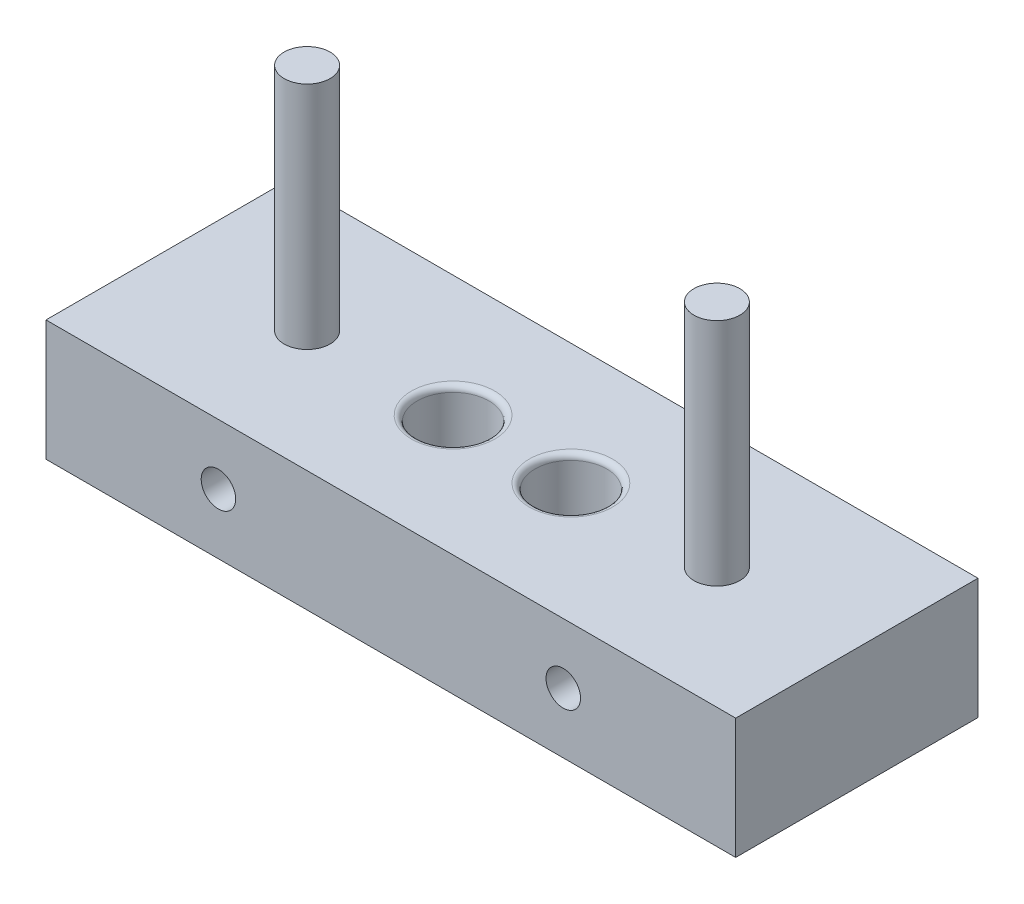
from build123d import *

# Parameters (mm, degrees)
SKETCH1_W           = 120
SKETCH1_H           = 42.16
BOSS_EXTRUDE1_DEPTH = 21
SKETCH2_R           = 6.25
CUT_EXTRUDE1_DEPTH  = 14
SKETCH3_R           = 3.25
CUT_EXTRUDE2_DEPTH  = 82.007752785
FILLET1_R           = 1
FILLET2_R           = 0.5
SKETCH4_R           = 4
BOSS_EXTRUDE2_DEPTH = 40
SKETCH19_R          = 3
CUT_EXTRUDE3_DEPTH  = 107.763288693


with BuildPart() as part:
    # Sketch1 → Boss-Extrude1 (new body)
    with BuildSketch(Plane(origin=(0, 0, 0), x_dir=(1, 0, 0), z_dir=(0, 1, 0))):
        with Locations((16.811029237, -0.514485382)):
            Rectangle(SKETCH1_W, SKETCH1_H)
    extrude(amount=BOSS_EXTRUDE1_DEPTH)

    # Sketch2 → Cut-Extrude1 (cut)
    with BuildSketch(Plane(origin=(0, 21, 0), x_dir=(1, 0, 0), z_dir=(0, 1, 0))):
        with Locations((27.061029237, -0.514485382)):
            Circle(SKETCH2_R)
        with Locations((6.561029237, -0.514485382)):
            Circle(SKETCH2_R)
    extrude(amount=-CUT_EXTRUDE1_DEPTH, mode=Mode.SUBTRACT)

    # Sketch3 → Cut-Extrude2 (cut, through all)
    with BuildSketch(Plane(origin=(0, 7, 0), x_dir=(1, 0, 0), z_dir=(0, 1, 0))):
        with Locations((27.061029237, -0.514485382)):
            Circle(SKETCH3_R)
        with Locations((6.561029237, -0.514485382)):
            Circle(SKETCH3_R)
    extrude(amount=-CUT_EXTRUDE2_DEPTH, mode=Mode.SUBTRACT)

    # Fillet1
    fillet1_edges = [part.edges().sort_by_distance(p)[0] for p in [
        (0.311029237, 21, 0.514485382),
        (20.811029237, 21, 0.514485382),
    ]]
    fillet(fillet1_edges, radius=FILLET1_R)

    # Fillet2
    fillet2_edges = [part.edges().sort_by_distance(p)[0] for p in [
        (3.311029237, 0, 0.514485382),
        (23.811029237, 0, 0.514485382),
    ]]
    fillet(fillet2_edges, radius=FILLET2_R)

    # Sketch4 → Boss-Extrude2 (add)
    with BuildSketch(Plane(origin=(0, 21, 0), x_dir=(1, 0, 0), z_dir=(0, 1, 0))):
        with Locations((52.461029237, -0.514485382)):
            Circle(SKETCH4_R)
        with Locations((-18.838970763, -0.514485382)):
            Circle(SKETCH4_R)
    extrude(amount=BOSS_EXTRUDE2_DEPTH)

    # Sketch19 → Cut-Extrude3 (cut, through all)
    with BuildSketch(Plane(origin=(0, 0, -20.565514618), x_dir=(-1, 0, 0), z_dir=(0, 0, -1))):
        with Locations((13.188970763, 10.5)):
            Circle(SKETCH19_R)
        with Locations((-46.811029237, 10.5)):
            Circle(SKETCH19_R)
    extrude(amount=-CUT_EXTRUDE3_DEPTH, mode=Mode.SUBTRACT)


solid = part.part
